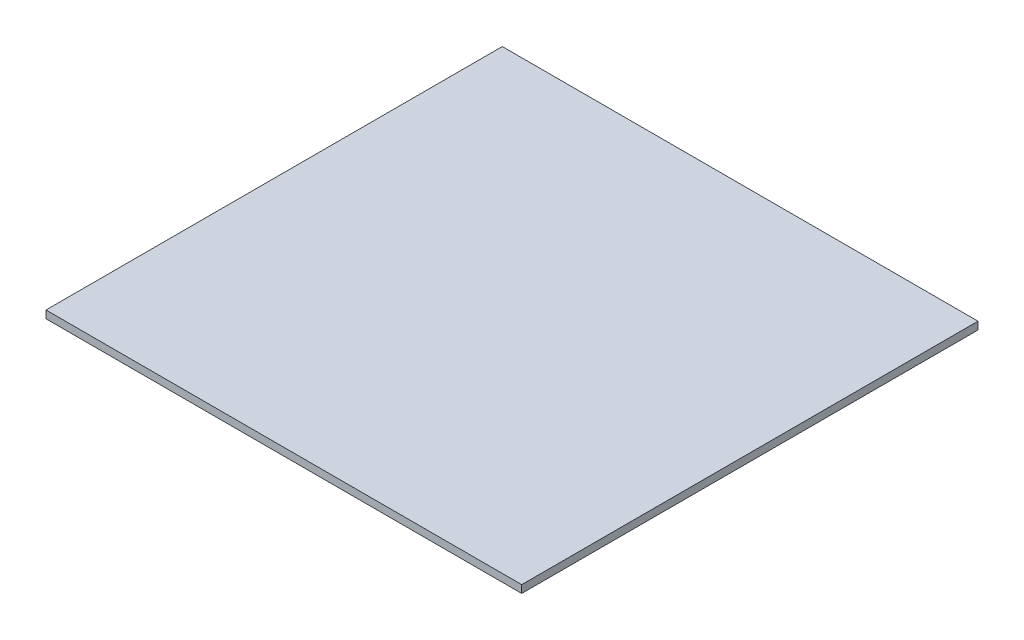
from build123d import *

# Parameters (mm, degrees)
SKETCH1_W           = 62.23
SKETCH1_H           = 59.69
BOSS_EXTRUDE1_DEPTH = 1


with BuildPart() as part:
    # Sketch1 → Boss-Extrude1 (new body)
    with BuildSketch(Plane(origin=(0, 0, 0), x_dir=(1, 0, 0), z_dir=(0, 1, 0))):
        with Locations((31.115, 29.845)):
            Rectangle(SKETCH1_W, SKETCH1_H)
    extrude(amount=BOSS_EXTRUDE1_DEPTH)


solid = part.part
